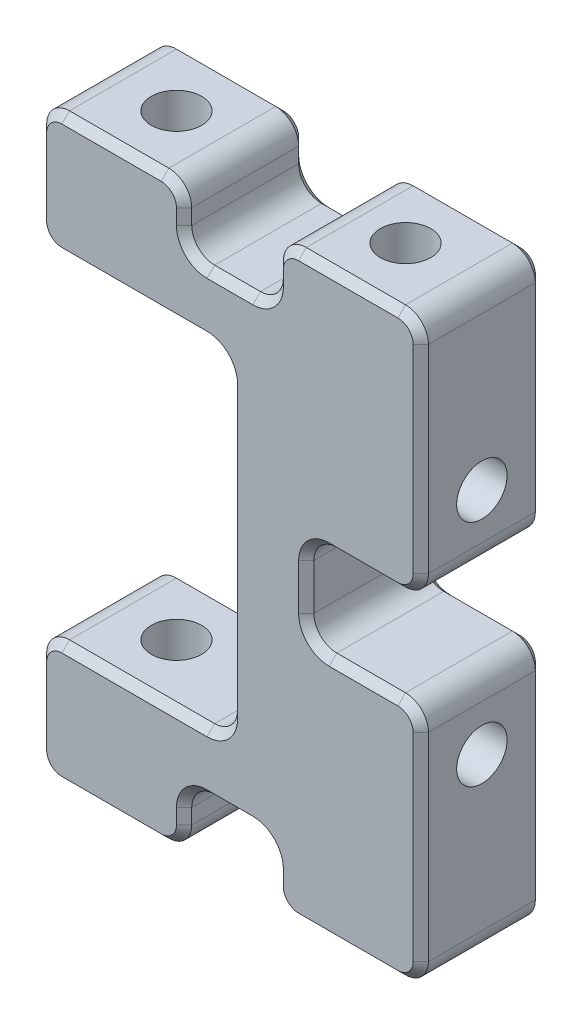
from build123d import *

# Parameters (mm, degrees)
EXTRUDE_1_DEPTH             = 4
SKETCH_2_R                  = 1.5
CUT_EXTRUDE_1_DEPTH         = 8
SKETCH_3_R                  = 1.5
CUT_EXTRUDE_2_DEPTH         = 24.092206478
HOLE_WIZARD_M4_1_D          = 3.3
HOLE_WIZARD_M4_2_AT_2_COUNT = 2
HOLE_WIZARD_M4_2_AT_2_PITCH = 15
SKETCH_9_W                  = 15
SKETCH_9_H                  = 6
SKETCH_9_W_2                = 6
SKETCH_9_H_2                = 8
CUT_EXTRUDE_3_DEPTH         = 25.109126902
FILLET_1_R                  = 1.5
CHAMFER_1_SIZE              = 0.5


with BuildPart() as part:
    # 草图1 → 凸台-拉伸1 (new, symmetric)
    with BuildSketch(Plane.XY):
        Polygon((12.5, 19), (-12.5, 19), (-12.5, 11), (0, 11), (0, -11), (-12.5, -11), (-12.5, -19), (12.5, -19), align=None)
    extrude(amount=EXTRUDE_1_DEPTH, both=True)

    # 草图2 → 切除-拉伸1 (cut)
    with BuildSketch(Plane(origin=(0, 19, 0), x_dir=(1, 0, 0), z_dir=(0, 1, 0))):
        with Locations(Location((-7.5, 0, 0), (0, 0, 270))):
            Circle(SKETCH_2_R)
        with Locations(Location((7.5, 0, 0), (0, 0, 270))):
            Circle(SKETCH_2_R)
    extrude(amount=-CUT_EXTRUDE_1_DEPTH, mode=Mode.SUBTRACT)

    # 草图3 → 切除-拉伸2 (cut, through all)
    with BuildSketch(Plane.ZY):
        with Locations((0, 7.5)):
            Circle(SKETCH_3_R)
        with Locations((0, -7.5)):
            Circle(SKETCH_3_R)
    extrude(amount=-CUT_EXTRUDE_2_DEPTH, mode=Mode.SUBTRACT)

    # M4 螺纹孔1 (through all)
    with Locations(Plane(origin=(12.5, 0, 0), x_dir=(0, 0, -1), z_dir=(1, 0, 0))):
        with Locations((0, 7.5), (0, -7.5)):
            Hole(HOLE_WIZARD_M4_1_D / 2)

    # 草图8 → M4 螺纹孔2 (revolve, cut)
    with BuildSketch(Plane(origin=(-7.5, 19, 0), x_dir=(0, 0, 1), z_dir=(1, 0, 0))):
        Polygon((0, 0), (0, 8.991420021), (1.65, 8), (1.65, 0), align=None)
    hole_wizard_m4_2 = revolve(axis=Axis((-7.5, 25.35, 0), (0, -1, 0)), mode=Mode.SUBTRACT)

    # M4 螺纹孔2 at 2: M4 螺纹孔2 ×2
    with Locations(*[(i * HOLE_WIZARD_M4_2_AT_2_PITCH, 0, 0) for i in range(1, HOLE_WIZARD_M4_2_AT_2_COUNT)]):
        add(hole_wizard_m4_2, mode=Mode.SUBTRACT)

    # 镜向1: M4 螺纹孔2 across plane
    add(hole_wizard_m4_2.mirror(Plane.ZX), mode=Mode.SUBTRACT)

    # 镜向1 copy 1 sketch → 镜向1 copy 1 (revolve, cut)
    with BuildSketch(Plane(origin=(7.5, -19, 0), x_dir=(0, 0, 1), z_dir=(1, 0, 0))):
        Polygon((0, 0), (0, -8.991420021), (1.65, -8), (1.65, 0), align=None)
    revolve(axis=Axis((7.5, -25.35, 0), (0, -1, 0)), mode=Mode.SUBTRACT)

    # 草图9 → 切除-拉伸3 (cut, through all)
    with BuildSketch(Plane.XY.offset(4)):
        with Locations((12.5, 0)):
            Rectangle(SKETCH_9_W, SKETCH_9_H)
        with Locations((0, 19)):
            Rectangle(SKETCH_9_W_2, SKETCH_9_H_2)
        with Locations((0, -19)):
            Rectangle(SKETCH_9_W_2, SKETCH_9_H_2)
    extrude(amount=-CUT_EXTRUDE_3_DEPTH, mode=Mode.SUBTRACT)

    # 圆角1
    fillet_1_edges = [part.edges().sort_by_distance(p)[0] for p in [
        (3, 19, 0),
        (-3, 19, 0),
        (3, 15, 0),
        (-3, 15, 0),
        (3, -19, 0),
        (3, -15, 0),
        (-3, -19, 0),
        (-3, -15, 0),
        (-12.5, 11, 0),
        (-12.5, 19, 0),
        (12.5, 19, 0),
        (12.5, -19, 0),
        (-12.5, -19, 0),
        (-12.5, -11, 0),
        (0, -11, 0),
        (0, 11, 0),
        (12.5, 3, 0),
        (12.5, -3, 0),
        (5, -3, 0),
        (5, 3, 0),
    ]]
    fillet(fillet_1_edges, radius=FILLET_1_R)

    # 倒角1
    chamfer_1_edges = [part.edges().sort_by_distance(p)[0] for p in [
        (7.75, -19, 4),
        (7.75, -19, -4),
        (12.5, 11, -4),
        (8.75, 3, -4),
        (5, 0, -4),
        (8.75, -3, -4),
        (12.5, -11, -4),
        (3, -17, -4),
        (0, -15, -4),
        (-3, -17, -4),
        (-7.75, -19, -4),
        (-12.5, -15, -4),
        (-6.25, -11, -4),
        (0, 0, -4),
        (-6.25, 11, -4),
        (-12.5, 15, -4),
        (-7.75, 19, -4),
        (-3, 17, -4),
        (0, 15, -4),
        (3, 17, -4),
        (7.75, 19, -4),
        (-12.060660172, 11.439339828, -4),
        (-12.060660172, -11.439339828, -4),
        (-12.060660172, -18.560660172, -4),
        (12.060660172, -18.560660172, -4),
        (12.060660172, 18.560660172, -4),
        (-12.060660172, 18.560660172, -4),
        (12.060660172, -3.439339828, -4),
        (12.060660172, 3.439339828, -4),
        (3.439339828, 18.560660172, -4),
        (-3.439339828, 18.560660172, -4),
        (-3.439339828, -18.560660172, -4),
        (3.439339828, -18.560660172, -4),
        (3, -17, 4),
        (8.75, 3, 4),
        (12.5, 11, 4),
        (7.75, 19, 4),
        (3, 17, 4),
        (0, 15, 4),
        (-3, 17, 4),
        (-7.75, 19, 4),
        (-12.5, 15, 4),
        (-6.25, 11, 4),
        (0, 0, 4),
        (-6.25, -11, 4),
        (-12.5, -15, 4),
        (-7.75, -19, 4),
        (-3, -17, 4),
        (0, -15, 4),
        (12.5, -11, 4),
        (8.75, -3, 4),
        (5, 0, 4),
        (-12.060660172, 11.439339828, 4),
        (-12.060660172, -11.439339828, 4),
        (-12.060660172, -18.560660172, 4),
        (12.060660172, -18.560660172, 4),
        (12.060660172, 18.560660172, 4),
        (-12.060660172, 18.560660172, 4),
        (12.060660172, -3.439339828, 4),
        (12.060660172, 3.439339828, 4),
        (3.439339828, 18.560660172, 4),
        (-3.439339828, 18.560660172, 4),
        (-3.439339828, -18.560660172, 4),
        (3.439339828, -18.560660172, 4),
        (2.560660172, -15.439339828, 4),
        (2.560660172, -15.439339828, -4),
        (-2.560660172, -15.439339828, 4),
        (-2.560660172, -15.439339828, -4),
        (-2.560660172, 15.439339828, 4),
        (-2.560660172, 15.439339828, -4),
        (2.560660172, 15.439339828, 4),
        (2.560660172, 15.439339828, -4),
        (5.439339828, 2.560660172, 4),
        (5.439339828, 2.560660172, -4),
        (5.439339828, -2.560660172, 4),
        (5.439339828, -2.560660172, -4),
        (-0.439339828, -10.560660172, -4),
        (-0.439339828, -10.560660172, 4),
        (-0.439339828, 10.560660172, -4),
        (-0.439339828, 10.560660172, 4),
    ]]
    chamfer(chamfer_1_edges, length=CHAMFER_1_SIZE)


solid = part.part
